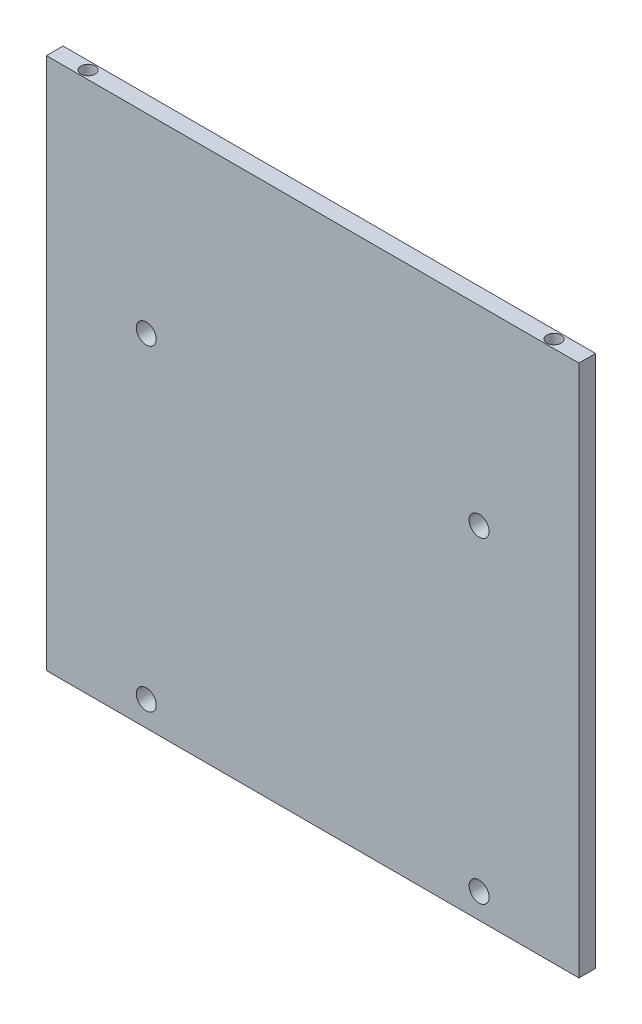
from build123d import *

# Parameters (mm, degrees)
SKETCH1_W                      = 101.6
SKETCH1_H                      = 101.6
BOSS_EXTRUDE1_DEPTH            = 3.175
F_6_32_TAPPED_HOLE1_AT_2_COUNT = 2
F_6_32_TAPPED_HOLE1_AT_2_PITCH = 88.9
CUT_EXTRUDE2_REACH             = 148.894
CUT_EXTRUDE2_START             = 3.175
SKETCH8_R                      = 1.905


with BuildPart() as part:
    # Sketch1 → Boss-Extrude1 (new body)
    with BuildSketch(Plane.XY):
        with Locations((50.8, 50.8)):
            Rectangle(SKETCH1_W, SKETCH1_H)
    extrude(amount=BOSS_EXTRUDE1_DEPTH)

    # Sketch7 → #6-32 Tapped Hole1 (revolve, cut)
    with BuildSketch(Plane(origin=(95.25, 101.6, 1.5875), x_dir=(0, 0, 1), z_dir=(1, 0, 0))):
        Polygon((0, 0), (0, 15.79869403), (1.35255, 14.986), (1.35255, 0), align=None)
    f_6_32_tapped_hole1 = revolve(axis=Axis((95.25, 107.95, 1.5875), (0, -1, 0)), mode=Mode.SUBTRACT)

    # #6-32 Tapped Hole1 at 2: #6-32 Tapped Hole1 ×2
    with Locations(*[(-i * F_6_32_TAPPED_HOLE1_AT_2_PITCH, 0, 0) for i in range(1, F_6_32_TAPPED_HOLE1_AT_2_COUNT)]):
        add(f_6_32_tapped_hole1, mode=Mode.SUBTRACT)

    # Mirror1: #6-32 Tapped Hole1 across plane
    add(f_6_32_tapped_hole1.mirror(Plane(origin=(0, 50.8, 0), x_dir=(0, 0, 1), z_dir=(0, -1, 0))), mode=Mode.SUBTRACT)

    # Mirror1 copy 1 sketch → Mirror1 copy 1 (revolve, cut)
    with BuildSketch(Plane(origin=(6.35, 0, 1.5875), x_dir=(0, 0, 1), z_dir=(1, 0, 0))):
        Polygon((0, 0), (0, -15.79869403), (1.35255, -14.986), (1.35255, 0), align=None)
    revolve(axis=Axis((6.35, -6.35, 1.5875), (0, -1, 0)), mode=Mode.SUBTRACT)

    # Sketch8 → Cut-Extrude2 (cut, up to next)
    with BuildSketch(Plane.XY.offset(CUT_EXTRUDE2_START), mode=Mode.PRIVATE) as cut_extrude2_sk1:
        with Locations((19.05, 65.2145)):
            Circle(SKETCH8_R)
    cut_extrude2_tool1 = extrude(cut_extrude2_sk1.sketch, amount=-CUT_EXTRUDE2_REACH, mode=Mode.PRIVATE) & part.part
    # Sketch8 → Cut-Extrude2 (cut, up to next)
    with BuildSketch(Plane.XY.offset(CUT_EXTRUDE2_START), mode=Mode.PRIVATE) as cut_extrude2_sk2:
        with Locations((19.05, 4.7625)):
            Circle(SKETCH8_R)
    cut_extrude2_tool2 = extrude(cut_extrude2_sk2.sketch, amount=-CUT_EXTRUDE2_REACH, mode=Mode.PRIVATE) & part.part
    # Sketch8 → Cut-Extrude2 (cut, up to next)
    with BuildSketch(Plane.XY.offset(CUT_EXTRUDE2_START), mode=Mode.PRIVATE) as cut_extrude2_sk3:
        with Locations((82.55, 4.7625)):
            Circle(SKETCH8_R)
    cut_extrude2_tool3 = extrude(cut_extrude2_sk3.sketch, amount=-CUT_EXTRUDE2_REACH, mode=Mode.PRIVATE) & part.part
    # Sketch8 → Cut-Extrude2 (cut, up to next)
    with BuildSketch(Plane.XY.offset(CUT_EXTRUDE2_START), mode=Mode.PRIVATE) as cut_extrude2_sk4:
        with Locations((82.55, 65.2145)):
            Circle(SKETCH8_R)
    cut_extrude2_tool4 = extrude(cut_extrude2_sk4.sketch, amount=-CUT_EXTRUDE2_REACH, mode=Mode.PRIVATE) & part.part
    add(cut_extrude2_tool1.solids().sort_by_distance((19.05, 65.2145, 3.175))[0], mode=Mode.SUBTRACT)
    add(cut_extrude2_tool2.solids().sort_by_distance((19.05, 4.7625, 3.175))[0], mode=Mode.SUBTRACT)
    add(cut_extrude2_tool3.solids().sort_by_distance((82.55, 4.7625, 3.175))[0], mode=Mode.SUBTRACT)
    add(cut_extrude2_tool4.solids().sort_by_distance((82.55, 65.2145, 3.175))[0], mode=Mode.SUBTRACT)


solid = part.part
